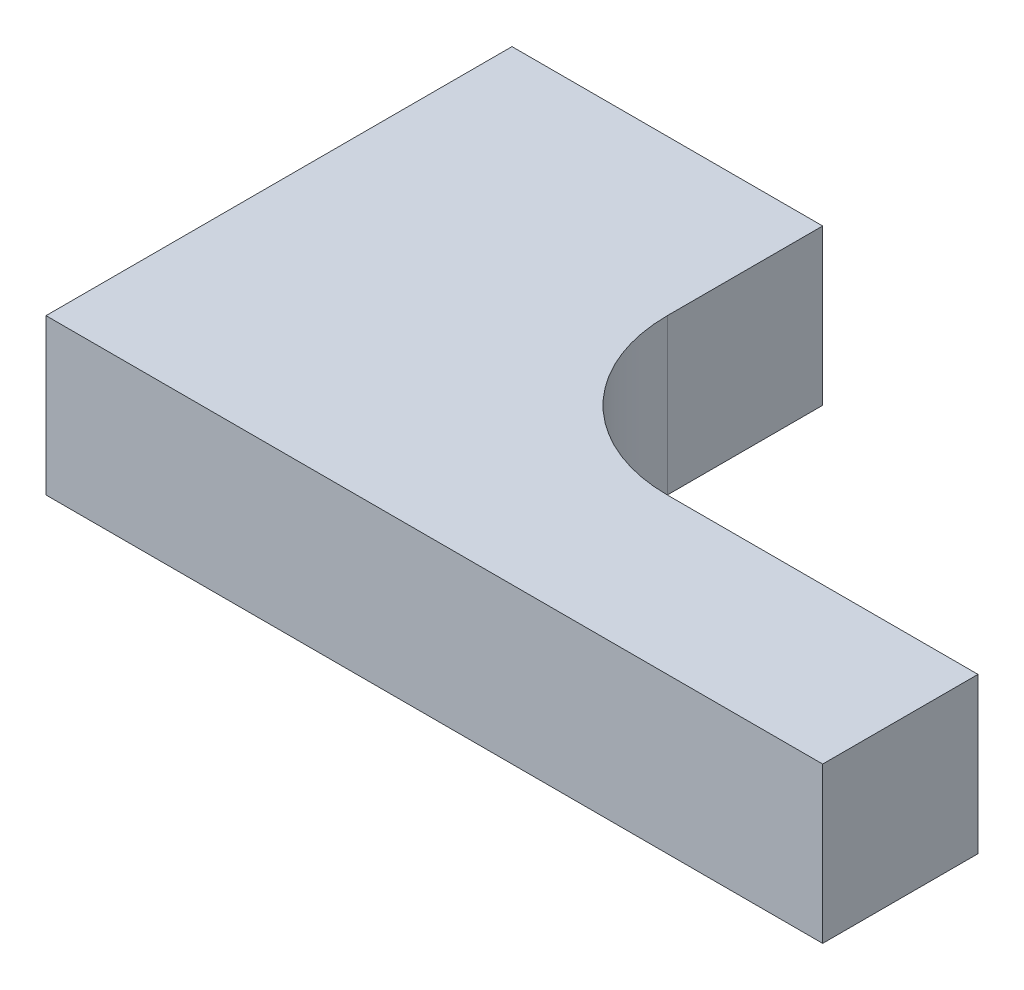
from build123d import *

# Parameters (mm, degrees)
BOSS_EXTRUDE1_DEPTH = 20


with BuildPart() as part:
    # Sketch2 → Boss-Extrude1 (new body)
    with BuildSketch(Plane(origin=(0, 0, 0), x_dir=(1, 0, 0), z_dir=(0, 1, 0))):
        with BuildLine():
            Line((0, 0), (0, -20))
            ThreePointArc((0, -20), (5.857864376, -34.142135624), (20, -40))
            Line((20, -40), (60, -40))
            Line((60, -40), (60, -60))
            Line((60, -60), (-40, -60))
            Line((-40, -60), (-40, 0))
            Line((-40, 0), (0, 0))
        make_face()
    extrude(amount=BOSS_EXTRUDE1_DEPTH)


solid = part.part
